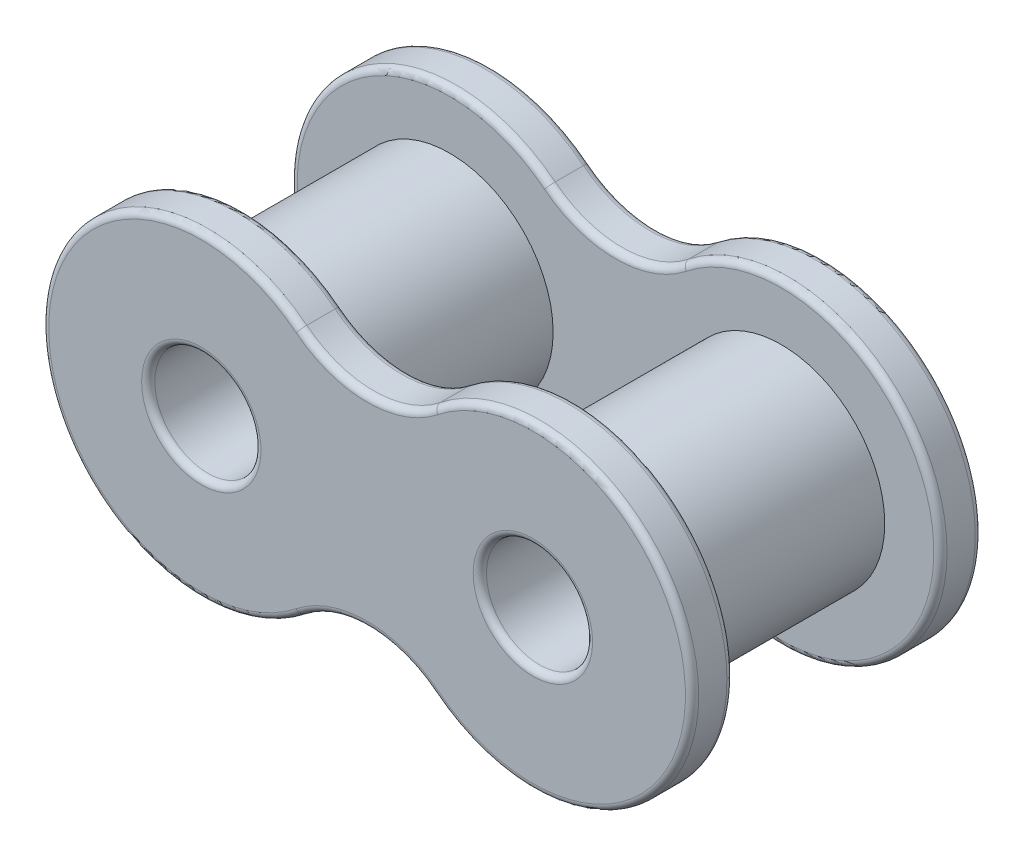
from build123d import *

# Parameters (mm, degrees)
SKETCH_1_R      = 2.032
EXTRUDE_1_DEPTH = 1.5875
FILLET_1_R      = 0.254
SKETCH_2_R      = 3.9624
SKETCH_2_R_2    = 2.032
EXTRUDE_2_DEPTH = 7.9248
FILLET_2_R      = 0.254


with BuildPart() as part:
    # 草圖1 → 填料-伸長1 (new body)
    with BuildSketch(Plane.XY):
        with BuildLine():
            ThreePointArc((-2.560083073, 4.774698491), (-12.446, 0), (-2.560083073, -4.774698491))
            ThreePointArc((-2.560083073, -4.774698491), (0, -3.882161348), (2.560083073, -4.774698491))
            ThreePointArc((2.560083073, -4.774698491), (12.446, 0), (2.560083073, 4.774698491))
            ThreePointArc((2.560083073, 4.774698491), (0, 3.882161348), (-2.560083073, 4.774698491))
        make_face()
        with Locations((-6.35, 0)):
            Circle(SKETCH_1_R, mode=Mode.SUBTRACT)
        with Locations(Location((6.35, 0, 0), (0, 0, 180))):
            Circle(SKETCH_1_R, mode=Mode.SUBTRACT)
    extrude_1 = extrude(amount=EXTRUDE_1_DEPTH)

    # 圓角1
    fillet_1_edges = [part.edges().sort_by_distance(p)[0] for p in [
        (0, -3.882161348, 1.5875),
        (-8.382, 0, 0),
        (-8.382, 0, 1.5875),
        (12.446, 0, 1.5875),
        (8.382, 0, 0),
        (8.382, 0, 1.5875),
        (0, 3.882161348, 1.5875),
        (12.446, 0, 0),
        (0, -3.882161348, 0),
        (-12.446, 0, 0),
        (0, 3.882161348, 0),
        (-12.446, 0, 1.5875),
    ]]
    fillet(fillet_1_edges, radius=FILLET_1_R)

    # 草圖2 → 填料-伸長2 (add)
    with BuildSketch(Plane.XY.offset(1.5875)):
        with Locations((-6.35, 0)):
            Circle(SKETCH_2_R)
        with Locations((-6.35, 0)):
            Circle(SKETCH_2_R_2, mode=Mode.SUBTRACT)
    extrude_2 = extrude(amount=EXTRUDE_2_DEPTH)

    # 鏡射1: 填料-伸長2 across plane
    add(extrude_2.mirror(Plane(origin=(0, 0, 0), x_dir=(0, 0, 1), z_dir=(1, 0, 0))))

    # 鏡射2: 填料-伸長1 across plane
    add(extrude_1.mirror(Plane.XY.offset(5.5499)))

    # 圓角2
    fillet_2_edges = [part.edges().sort_by_distance(p)[0] for p in [
        (0, 3.882161348, 9.5123),
        (12.446, 0, 9.5123),
        (0, -3.882161348, 9.5123),
        (-12.446, 0, 9.5123),
        (0, 3.882161348, 11.0998),
        (-12.446, 0, 11.0998),
        (0, -3.882161348, 11.0998),
        (12.446, 0, 11.0998),
        (-8.382, 0, 11.0998),
        (8.382, 0, 11.0998),
    ]]
    fillet(fillet_2_edges, radius=FILLET_2_R)


solid = part.part
